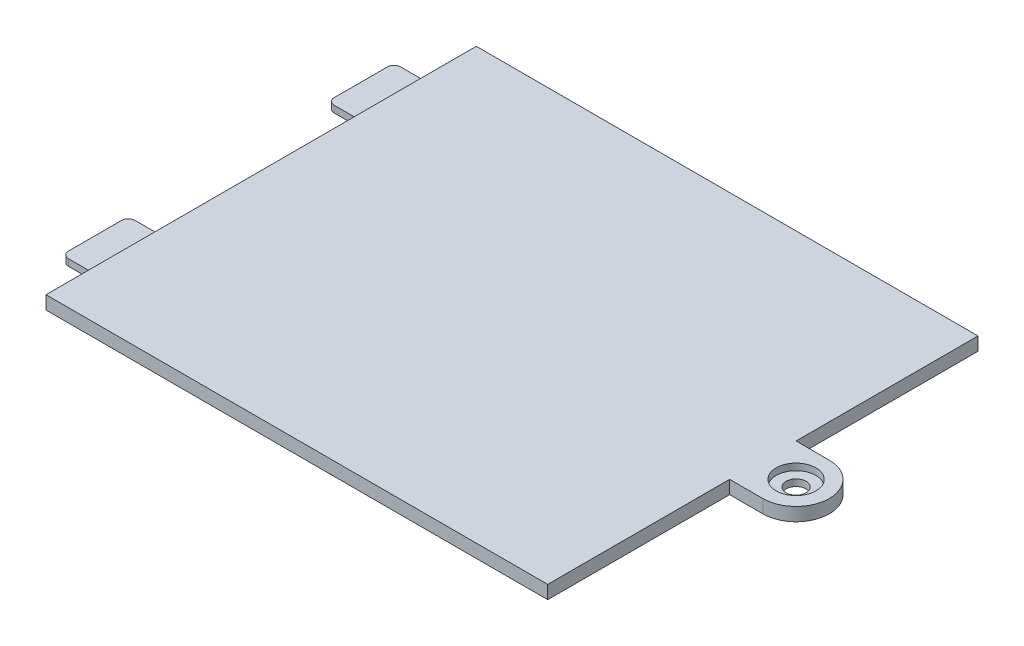
from build123d import *

# Parameters (mm, degrees)
SKETCH1_W           = 75.52
SKETCH1_H           = 64.77
BOSS_EXTRUDE1_DEPTH = 2
BOSS_EXTRUDE2_DEPTH = 2
SKETCH3_W           = 10
SKETCH3_H           = 1
BOSS_EXTRUDE3_DEPTH = 5
SKETCH7_R           = 1.5
CUT_EXTRUDE2_DEPTH  = 2
SKETCH9_R           = 3
SKETCH9_R_2         = 1.5
CUT_EXTRUDE4_DEPTH  = 1
FILLET1_R           = 1


with BuildPart() as part:
    # Sketch1 → Boss-Extrude1 (new body)
    with BuildSketch(Plane(origin=(0, 0, 0), x_dir=(1, 0, 0), z_dir=(0, 1, 0))):
        Rectangle(SKETCH1_W, SKETCH1_H)
    extrude(amount=BOSS_EXTRUDE1_DEPTH)

    # Sketch2 → Boss-Extrude2 (add)
    with BuildSketch(Plane(origin=(0, 2, 0), x_dir=(1, 0, 0), z_dir=(0, 1, 0))):
        with BuildLine():
            Line((37.76, 5), (42.76, 5))
            ThreePointArc((42.76, 5), (47.76, 0), (42.76, -5))
            Line((42.76, -5), (37.76, -5))
            Line((37.76, -5), (37.76, 5))
        make_face()
    extrude(amount=-BOSS_EXTRUDE2_DEPTH)

    # Sketch3 → Boss-Extrude3 (add)
    with BuildSketch(Plane.ZY.offset(37.76)):
        with Locations((-20, 0.5)):
            Rectangle(SKETCH3_W, SKETCH3_H)
        with Locations((20, 0.5)):
            Rectangle(SKETCH3_W, SKETCH3_H)
    extrude(amount=BOSS_EXTRUDE3_DEPTH)

    # Sketch7 → Cut-Extrude2 (cut)
    with BuildSketch(Plane(origin=(0, 2, 0), x_dir=(1, 0, 0), z_dir=(0, 1, 0))):
        with Locations(Location((42.76, 0, 0), (0, 0, 270))):
            Circle(SKETCH7_R)
    extrude(amount=-CUT_EXTRUDE2_DEPTH, mode=Mode.SUBTRACT)

    # Sketch9 → Cut-Extrude4 (cut)
    with BuildSketch(Plane(origin=(0, 2, 0), x_dir=(1, 0, 0), z_dir=(0, 1, 0))):
        with Locations(Location((42.76, 0, 0), (0, 0, 270))):
            Circle(SKETCH9_R)
        with Locations(Location((42.76, 0, 0), (0, 0, 270))):
            Circle(SKETCH9_R_2, mode=Mode.SUBTRACT)
    extrude(amount=-CUT_EXTRUDE4_DEPTH, mode=Mode.SUBTRACT)

    # Fillet1
    fillet1_edges = [part.edges().sort_by_distance(p)[0] for p in [
        (-42.76, 0.5, -15),
        (-42.76, 0.5, -25),
        (-42.76, 0.5, 25),
        (-42.76, 0.5, 15),
    ]]
    fillet(fillet1_edges, radius=FILLET1_R)


solid = part.part
